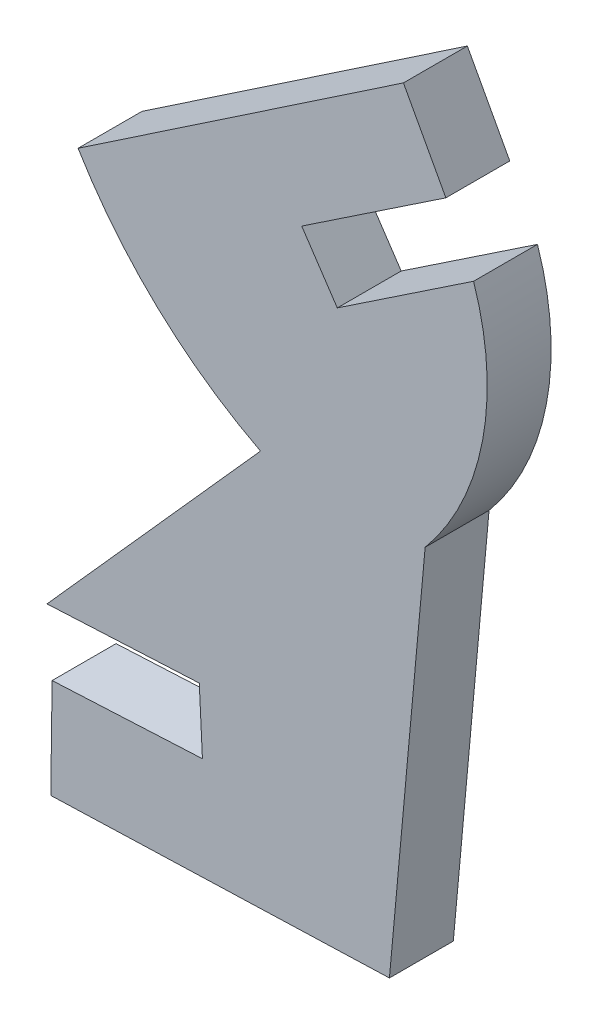
from build123d import *

# Parameters (mm, degrees)
BASE_EXTRUDE_DEPTH = 3


with BuildPart() as part:
    # Sketch1 → Base-Extrude (new body)
    with BuildSketch(Plane.XY):
        with BuildLine():
            Line((171.192957442, -40.665135082), (172.870030556, -22.31508098))
            ThreePointArc((172.870030556, -22.31508098), (175.563665965, -16.636900634), (175.142919492, -10.366304477))
            Line((175.142919492, -10.366304477), (168.744811214, -14.64960541))
            Line((168.744811214, -14.64960541), (167.075886495, -12.156677356))
            Line((167.075886495, -12.156677356), (173.841852345, -7.62710915))
            Line((173.841852345, -7.62710915), (171.850357265, -3.949661926))
            Line((171.850357265, -3.949661926), (156.57808296, -14.242043783))
            ThreePointArc((156.57808296, -14.242043783), (160.301341172, -18.851655885), (165.14064427, -22.271059484))
            Line((165.14064427, -22.271059484), (155.118780374, -33.49392187))
            Line((155.118780374, -33.49392187), (162.266864396, -33.140436707))
            Line((162.266864396, -33.140436707), (162.415219603, -36.140436707))
            Line((162.415219603, -36.140436707), (155.359396637, -36.4893594))
            Line((155.359396637, -36.4893594), (155.295598836, -41.193899126))
            Line((155.295598836, -41.193899126), (171.192957442, -40.665135082))
        make_face()
    extrude(amount=BASE_EXTRUDE_DEPTH)


solid = part.part
